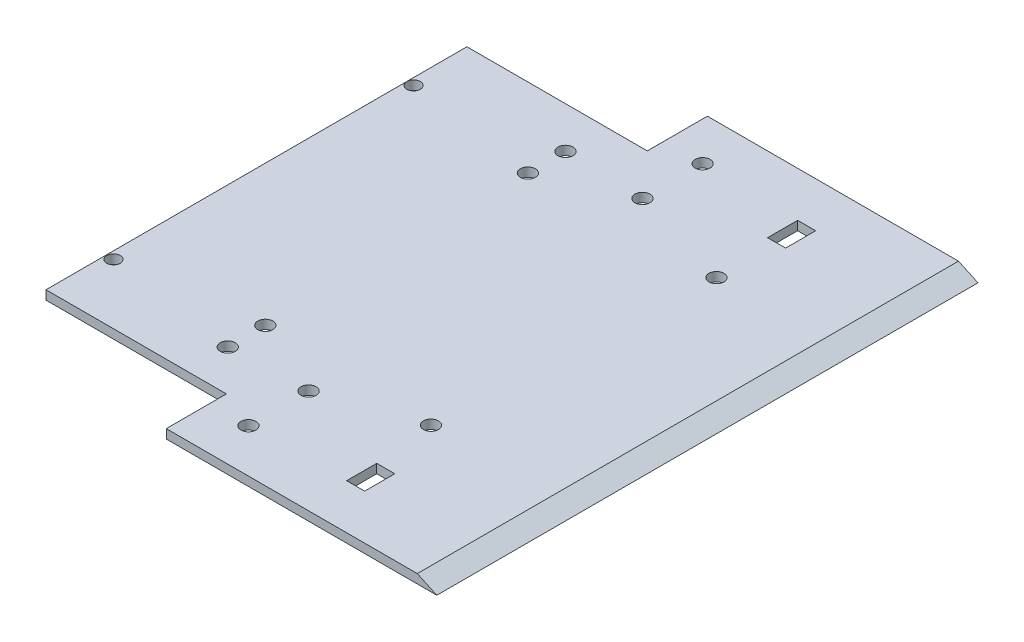
from build123d import *

# Parameters (mm, degrees)
ESQUISSE1_R             = 2.25
ESQUISSE1_R_2           = 2.5
ESQUISSE1_W             = 6
ESQUISSE1_H             = 10
ESQUISSE1_R_3           = 2.500458525
BOSS_EXTRU_1_DEPTH      = 3
ENL_V_MAT_EXTRU_2_DEPTH = 216


with BuildPart() as part:
    # Esquisse1 → Boss.-Extru.1 (new body)
    with BuildSketch(Plane(origin=(0, 0, 0), x_dir=(1, 0, 0), z_dir=(0, 1, 0))):
        Polygon((-15, -90), (75, -90), (75, 90), (-15, 90), (-15, 70), (-75, 70), (-75, -70), (-15, -70), align=None)
        with Locations(Location((-72.531396859, -50.020890538, 0), (0, 0, 270))):
            Circle(ESQUISSE1_R, mode=Mode.SUBTRACT)
        with Locations(Location((-2.161539128, -75.5, 0), (0, 0, 270))):
            Circle(ESQUISSE1_R_2, mode=Mode.SUBTRACT)
        with Locations(Location((-28.276866627, -56.270890538, 0), (0, 0, 270))):
            Circle(ESQUISSE1_R_2, mode=Mode.SUBTRACT)
        with Locations(Location((-2.161539128, -55.5, 0), (0, 0, 270))):
            Circle(ESQUISSE1_R_2, mode=Mode.SUBTRACT)
        with Locations(Location((-28.276866627, -43.770890538, 0), (0, 0, 270))):
            Circle(ESQUISSE1_R_2, mode=Mode.SUBTRACT)
        with Locations((33, -70)):
            Rectangle(ESQUISSE1_W, ESQUISSE1_H, mode=Mode.SUBTRACT)
        with Locations(Location((28.039441899, -45, 0), (0, 0, 270))):
            Circle(ESQUISSE1_R_3, mode=Mode.SUBTRACT)
        with Locations(Location((-28.476498774, 43.75, 0), (0, 0, 270))):
            Circle(ESQUISSE1_R_2, mode=Mode.SUBTRACT)
        with Locations(Location((-72.731029006, 50, 0), (0, 0, 270))):
            Circle(ESQUISSE1_R, mode=Mode.SUBTRACT)
        with Locations(Location((-28.476498774, 56.25, 0), (0, 0, 270))):
            Circle(ESQUISSE1_R_2, mode=Mode.SUBTRACT)
        with Locations(Location((-2.111629991, 55.5, 0), (0, 0, 270))):
            Circle(ESQUISSE1_R_2, mode=Mode.SUBTRACT)
        with Locations(Location((-2.111629991, 75.5, 0), (0, 0, 270))):
            Circle(ESQUISSE1_R_2, mode=Mode.SUBTRACT)
        with Locations(Location((33, 45, 0), (0, 0, 270))):
            Circle(ESQUISSE1_R_2, mode=Mode.SUBTRACT)
        with Locations((33, 70)):
            Rectangle(ESQUISSE1_W, ESQUISSE1_H, mode=Mode.SUBTRACT)
    extrude(amount=BOSS_EXTRU_1_DEPTH)

    # Esquisse4 → Enlèv. mat.-Extru.2 (cut)
    with BuildSketch(Plane.XY.offset(90)):
        Polygon((68.505970044, 3), (75, 0), (83.303291845, 0), (76.039441899, 3), align=None)
    extrude(amount=-ENL_V_MAT_EXTRU_2_DEPTH, mode=Mode.SUBTRACT)


solid = part.part
